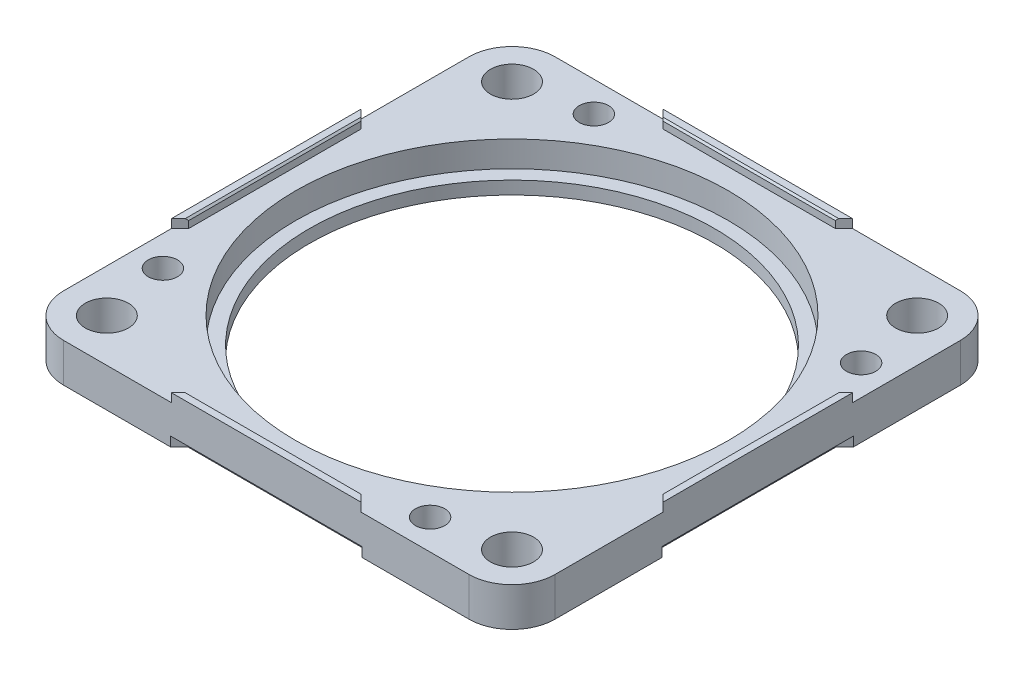
from build123d import *

# Parameters (mm, degrees)
SKETCH_1_W                           = 57
SKETCH_1_H                           = 57
EXTRUDE_1_DEPTH                      = 4.5
FILLET_1_R                           = 5
SKETCH_2_R                           = 25.1
CUT_EXTRUDE_1_DEPTH                  = 3
SKETCH_3_R                           = 23.5
CUT_EXTRUDE_2_DEPTH                  = 1.5
SKETCH_4_R                           = 2.5
SKETCH_4_R_2                         = 1.7
CUT_EXTRUDE_3_DEPTH                  = 41.555517504
EXTRUDE_2_DEPTH                      = 1
CHAMFER_1_SIZE                       = 0.2
CUT_EXTRUDE_4_DEPTH                  = 1.1
PATTERN_CIRCULAR_1_COUNT             = 4
CHAMFER_1_OF_PATTERN_CIRCULAR_1_SIZE = 0.2


with BuildPart() as part:
    # 草图1 → 凸台-拉伸1 (new body)
    with BuildSketch(Plane(origin=(0, 0, 0), x_dir=(1, 0, 0), z_dir=(0, 1, 0))):
        Rectangle(SKETCH_1_W, SKETCH_1_H)
    extrude(amount=EXTRUDE_1_DEPTH)

    # 圆角1
    fillet_1_edges = [part.edges().sort_by_distance(p)[0] for p in [
        (28.5, 2.25, 28.5),
        (-28.5, 2.25, 28.5),
        (-28.5, 2.25, -28.5),
        (28.5, 2.25, -28.5),
    ]]
    fillet(fillet_1_edges, radius=FILLET_1_R)

    # 草图2 → 切除-拉伸1 (cut)
    with BuildSketch(Plane(origin=(0, 4.5, 0), x_dir=(1, 0, 0), z_dir=(0, 1, 0))):
        with Locations(Location((0, 0, 0), (0, 0, 270))):
            Circle(SKETCH_2_R)
    extrude(amount=-CUT_EXTRUDE_1_DEPTH, mode=Mode.SUBTRACT)

    # 草图3 → 切除-拉伸2 (cut)
    with BuildSketch(Plane(origin=(0, 1.5, 0), x_dir=(1, 0, 0), z_dir=(0, 1, 0))):
        with Locations(Location((0, 0, 0), (0, 0, 270))):
            Circle(SKETCH_3_R)
    extrude(amount=-CUT_EXTRUDE_2_DEPTH, mode=Mode.SUBTRACT)

    # 草图4 → 切除-拉伸3 (cut, through all)
    with BuildSketch(Plane(origin=(0, 4.5, 0), x_dir=(1, 0, 0), z_dir=(0, 1, 0))):
        with Locations(Location((-23.5, 23.5, 0), (0, 0, 270))):
            Circle(SKETCH_4_R)
        with Locations(Location((-15.5, 25, 0), (0, 0, 270))):
            Circle(SKETCH_4_R_2)
    cut_extrude_3 = extrude(amount=-CUT_EXTRUDE_3_DEPTH, mode=Mode.SUBTRACT)

    # 草图5 → 凸台-拉伸2 (add)
    with BuildSketch(Plane(origin=(0, 4.5, 0), x_dir=(1, 0, 0), z_dir=(0, 1, 0))):
        Polygon((-28.5, 11), (-28.5, -11), (-27.5, -10), (-27.5, 10), align=None)
    extrude_2 = extrude(amount=EXTRUDE_2_DEPTH)

    # 倒角1
    chamfer_1_edges = [part.edges().sort_by_distance(p)[0] for p in [
        (-27.5, 5.5, 0),
    ]]
    chamfer(chamfer_1_edges, length=CHAMFER_1_SIZE)

    # 草图6 → 切除-拉伸4 (cut)
    with BuildSketch(Plane.XZ):
        Polygon((-28.5, 11.1), (-28.5, -11.1), (-27.5, -10.1), (-27.5, 10.1), align=None)
    cut_extrude_4 = extrude(amount=-CUT_EXTRUDE_4_DEPTH, mode=Mode.SUBTRACT)

    # 阵列(圆周)1: 切除-拉伸3, 凸台-拉伸2, 切除-拉伸4 ×4 about axis
    pattern_circular_1_axis = Axis((0, 0, 0), (0, 1, 0))
    add([cut_extrude_3.rotate(pattern_circular_1_axis, i * 360 / PATTERN_CIRCULAR_1_COUNT) for i in range(1, PATTERN_CIRCULAR_1_COUNT)], mode=Mode.SUBTRACT)
    add([extrude_2.rotate(pattern_circular_1_axis, i * 360 / PATTERN_CIRCULAR_1_COUNT) for i in range(1, PATTERN_CIRCULAR_1_COUNT)])
    add([cut_extrude_4.rotate(pattern_circular_1_axis, i * 360 / PATTERN_CIRCULAR_1_COUNT) for i in range(1, PATTERN_CIRCULAR_1_COUNT)], mode=Mode.SUBTRACT)

    # 倒角1 of 阵列(圆周)1
    chamfer_1_of_pattern_circular_1_edges = [part.edges().sort_by_distance(p)[0] for p in [
        (0, 5.5, 27.5),
        (27.5, 5.5, 0),
        (0, 5.5, -27.5),
    ]]
    chamfer(chamfer_1_of_pattern_circular_1_edges, length=CHAMFER_1_OF_PATTERN_CIRCULAR_1_SIZE)


solid = part.part
